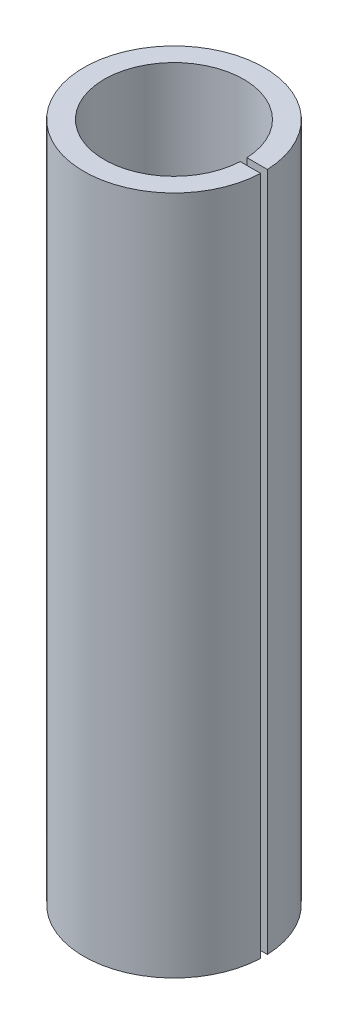
from build123d import *

# Parameters (mm, degrees)
SKETCH1_W          = 0.6
SKETCH1_H          = 20
SKETCH2_W          = 0.2
SKETCH2_H          = 20
CUT_EXTRUDE1_DEPTH = 5.3


with BuildPart() as part:
    # Sketch1 → Revolve1 (revolve)
    with BuildSketch(Plane.XY, mode=Mode.PRIVATE) as revolve1_sk:
        with Locations((2.35, 10)):
            Rectangle(SKETCH1_W, SKETCH1_H)
    revolve(revolve1_sk.sketch.rotate(Axis((0, 0, 0), (0, 1, 0)), 270), axis=Axis((0, 0, 0), (0, 1, 0)))

    # Sketch2 → Cut-Extrude1 (cut)
    with BuildSketch(Plane(origin=(0, 0, 0), x_dir=(0, 0, -1), z_dir=(1, 0, 0))):
        with Locations((0, 10)):
            Rectangle(SKETCH2_W, SKETCH2_H)
    extrude(amount=CUT_EXTRUDE1_DEPTH, mode=Mode.SUBTRACT)


solid = part.part
